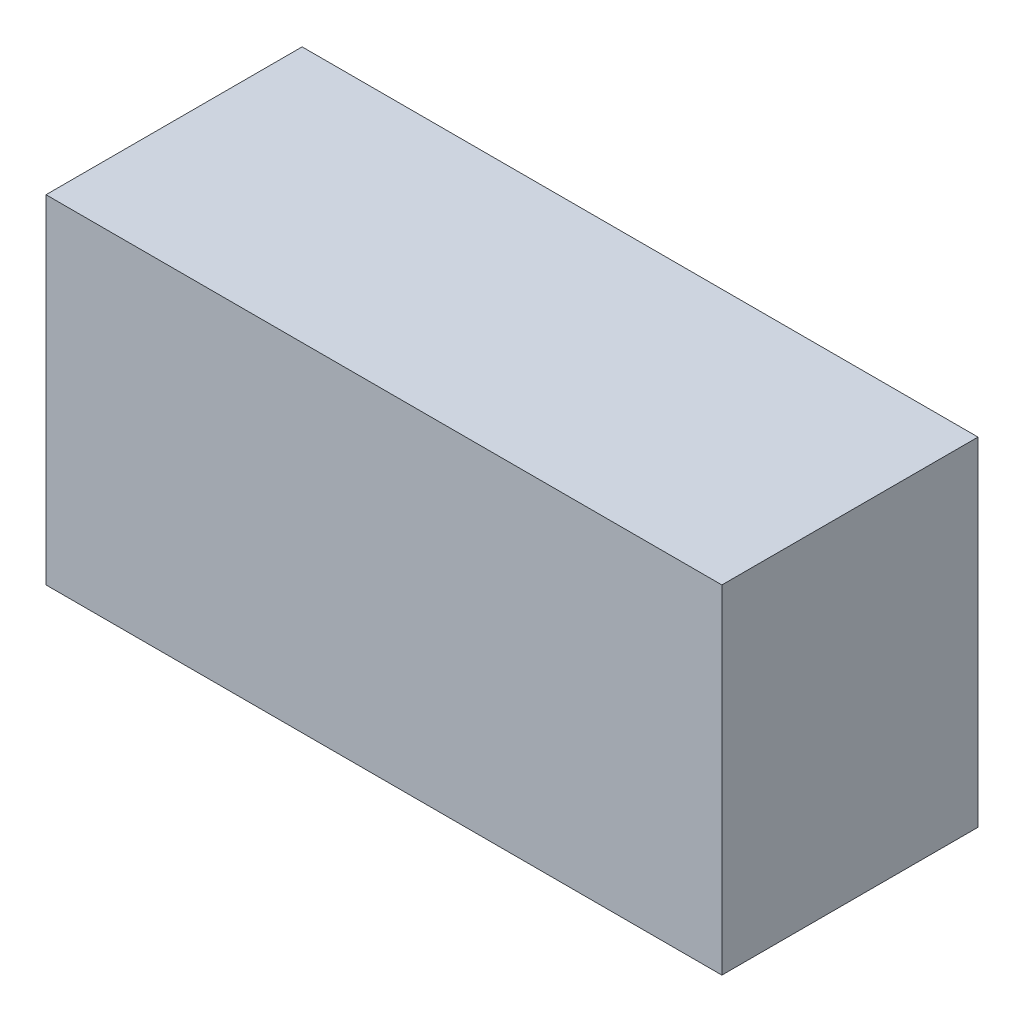
from build123d import *

# Parameters (mm, degrees)
SKETCH1_W           = 101.6
SKETCH1_H           = 50.8
BOSS_EXTRUDE1_DEPTH = 38.5


with BuildPart() as part:
    # Sketch1 → Boss-Extrude1 (new body)
    with BuildSketch(Plane.XY):
        Rectangle(SKETCH1_W, SKETCH1_H)
    extrude(amount=BOSS_EXTRUDE1_DEPTH)


solid = part.part
